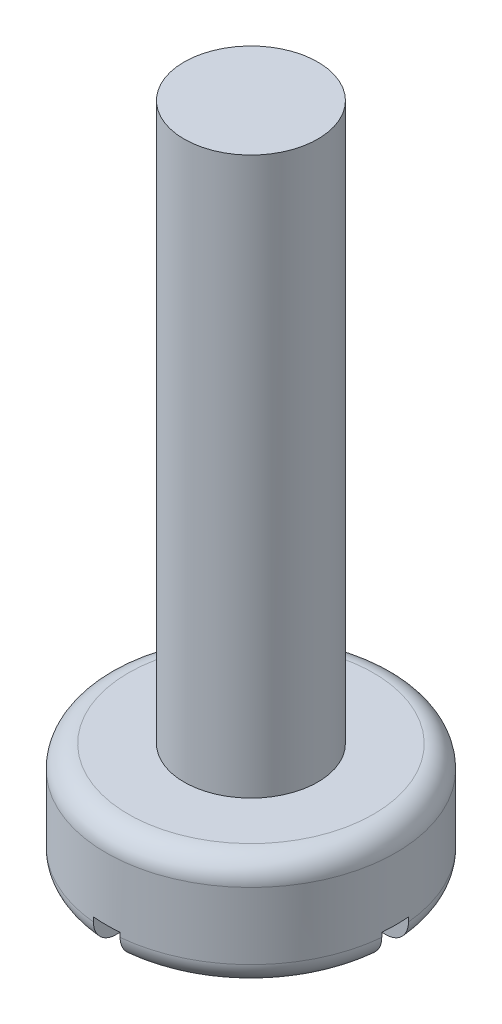
from build123d import *

# Parameters (mm, degrees)
SKETCH1_R           = 3
BOSS_EXTRUDE1_DEPTH = 25
CUT_EXTRUDE1_DEPTH  = 1.2


with BuildPart() as part:
    # Sketch1 → Boss-Extrude1 (new body)
    with BuildSketch(Plane(origin=(0, 0, 0), x_dir=(1, 0, 0), z_dir=(0, 1, 0))):
        with Locations(Location((0, 0, 0), (0, 0, 270))):
            Circle(SKETCH1_R)
    extrude(amount=BOSS_EXTRUDE1_DEPTH)

    # Sketch2 → Revolve1 (revolve)
    with BuildSketch(Plane.XY):
        with BuildLine():
            Line((0, 0), (0, -5))
            Line((0, -5), (-5.5, -5))
            ThreePointArc((-5.5, -5), (-6.207106781, -4.707106781), (-6.5, -4))
            Line((-6.5, -4), (-6.5, -1))
            ThreePointArc((-6.5, -1), (-6.207106781, -0.292893219), (-5.5, 0))
            Line((-5.5, 0), (0, 0))
        make_face()
    revolve(axis=Axis((0, 0, 0), (0, -1, 0)))

    # Sketch3 → Cut-Extrude1 (cut)
    with BuildSketch(Plane.XZ.offset(5)):
        Polygon((0.6, 8.375375313), (-0.6, 8.375375313), (-0.6, 0.8), (-0.8, 0.6), (-7.394108803, 0.6), (-7.394108803, -0.6), (-0.8, -0.6), (-0.6, -0.8), (-0.6, -7.930485814), (0.6, -7.930485814), (0.6, -0.8), (0.8, -0.6), (8.840235389, -0.6), (8.840235389, 0.6), (0.8, 0.6), (0.6, 0.8), align=None)
    extrude(amount=-CUT_EXTRUDE1_DEPTH, mode=Mode.SUBTRACT)


solid = part.part
